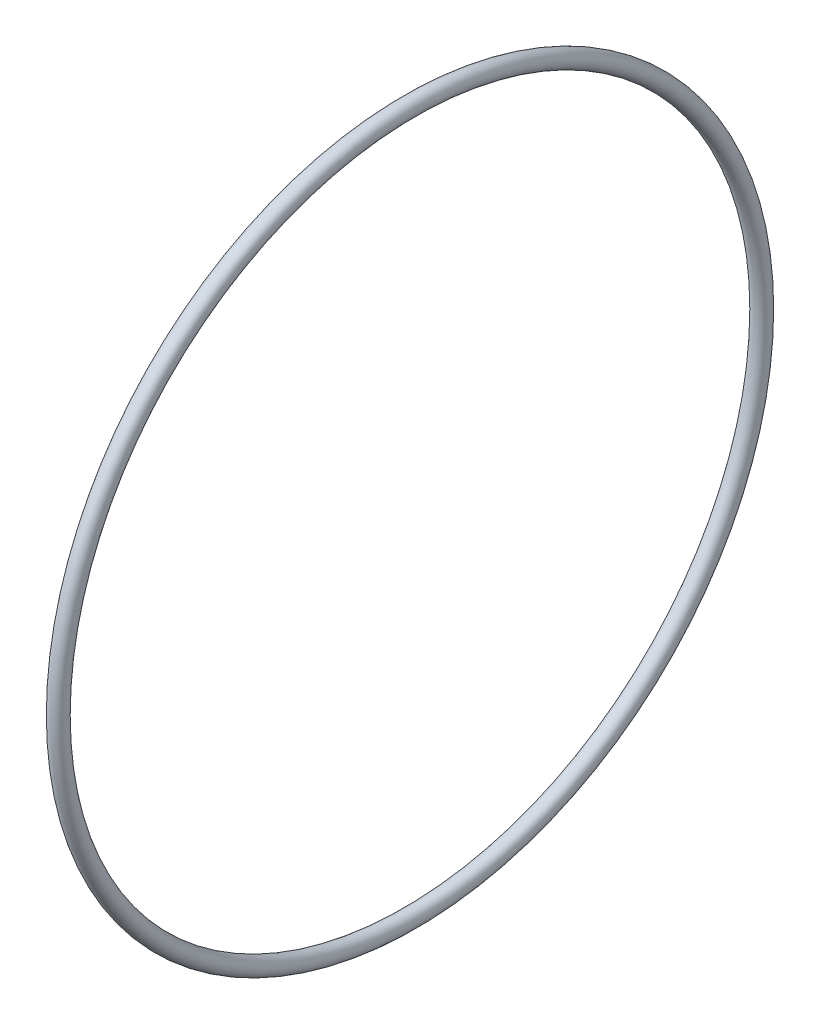
from build123d import *

# Parameters (mm, degrees)
WYCI_GNI_CIE_PO_CIE_CE1_PROFILE_R = 1.5


with BuildPart() as part:
    # Wyciągnięcie po ścieżce1: sweep along a path in Szkic1
    with BuildLine(Plane(origin=(0, 0, 0), x_dir=(0, 0, -1), z_dir=(1, 0, 0))) as wyci_gni_cie_po_cie_ce1_path:
        CenterArc((0, 0), 62.5, 0, 360)
    # Wyciągnięcie po ścieżce1 profile (on start of the path) → Wyciągnięcie po ścieżce1 (sweep)
    with BuildSketch(Plane(origin=(0, 0, -62.5), x_dir=(0, 0, 1), z_dir=(0, 1, 0))):
        Circle(WYCI_GNI_CIE_PO_CIE_CE1_PROFILE_R)
    sweep(path=wyci_gni_cie_po_cie_ce1_path.line)


solid = part.part
